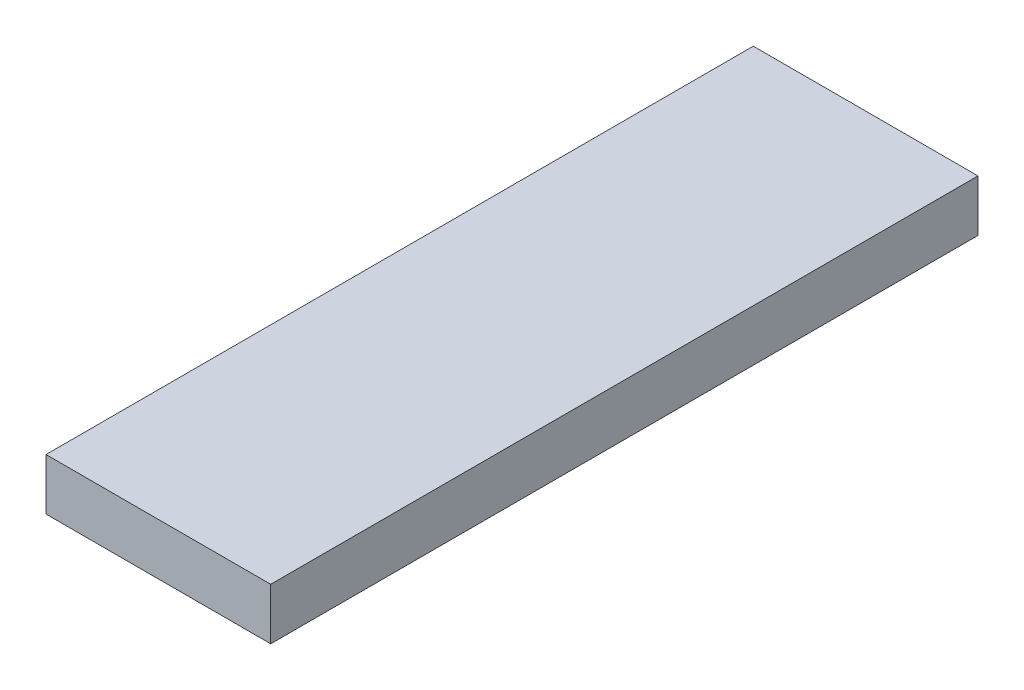
from build123d import *

# Parameters (mm, degrees)
SKETCH1_W           = 387.35
SKETCH1_H           = 1219.2
BOSS_EXTRUDE1_DEPTH = 88.9


with BuildPart() as part:
    # Sketch1 → Boss-Extrude1 (new body)
    with BuildSketch(Plane(origin=(0, 0, 0), x_dir=(1, 0, 0), z_dir=(0, 1, 0))):
        Rectangle(SKETCH1_W, SKETCH1_H)
    extrude(amount=BOSS_EXTRUDE1_DEPTH)


solid = part.part
